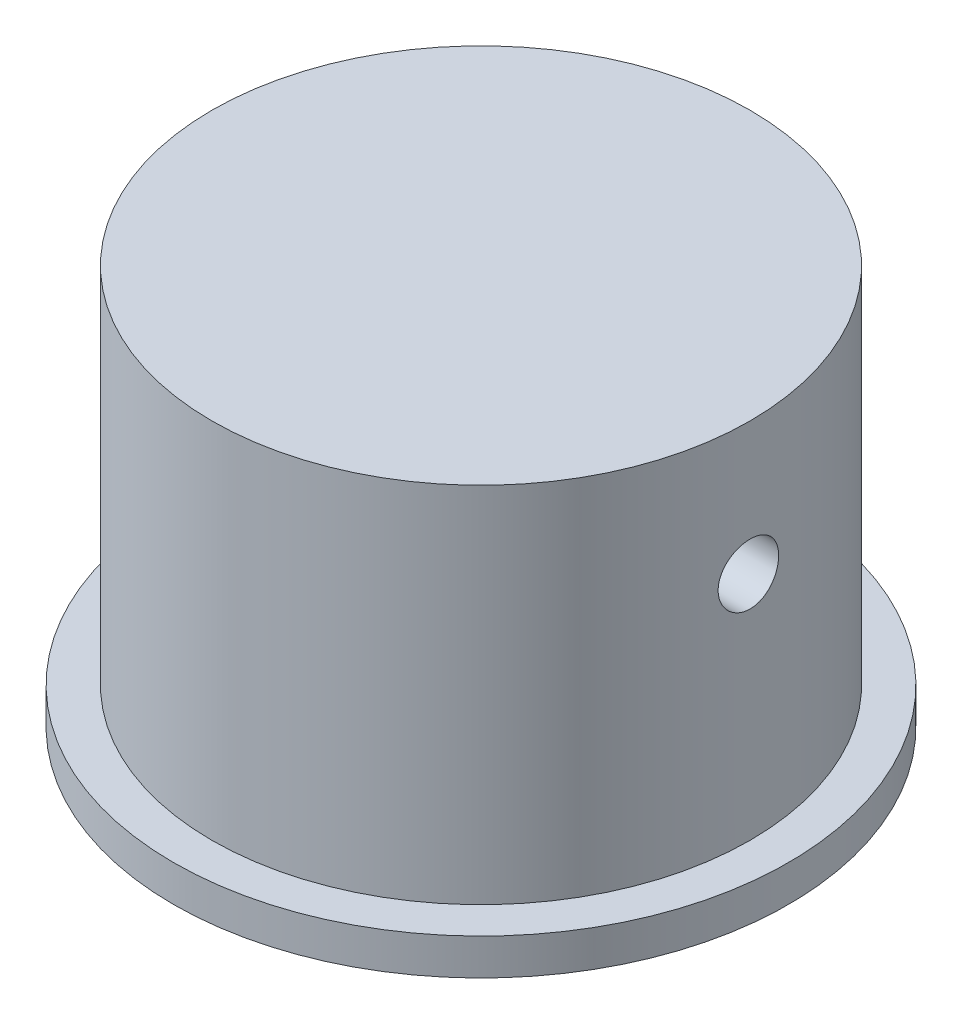
from build123d import *


with BuildPart() as part:
    # Sketch1 → Revolve1 (revolve)
    with BuildSketch(Plane(origin=(0, 0, 0), x_dir=(0, 0, -1), z_dir=(1, 0, 0)), mode=Mode.PRIVATE) as revolve1_sk:
        Polygon((-12.7, 0), (-12.7, 1.5), (-11.1125, 1.5), (-11.1125, 16.5), (0, 16.5), (0, 5), (-2.8067, 5), (-2.8067, 0), align=None)
    revolve(revolve1_sk.sketch.rotate(Axis((0, -1000, 0), (0, 1, 0)), 180), axis=Axis((0, -1000, 0), (0, 1, 0)))

    # Sketch4 → M3x0.5 Tapped Hole1 (revolve, cut)
    with BuildSketch(Plane(origin=(11.1125, 11.025, 0), x_dir=(0, 0, -1), z_dir=(0, 1, 0))):
        Polygon((0, 0), (0, 10.751075774), (1.25, 10), (1.25, 0), align=None)
    m3x0_5_tapped_hole1 = revolve(axis=Axis((17.4625, 11.025, 0), (-1, 0, 0)), mode=Mode.SUBTRACT)

    # Mirror1: M3x0.5 Tapped Hole1 across plane
    add(m3x0_5_tapped_hole1.mirror(Plane(origin=(0, 0, 0), x_dir=(0, 0, 1), z_dir=(1, 0, 0))), mode=Mode.SUBTRACT)


solid = part.part
